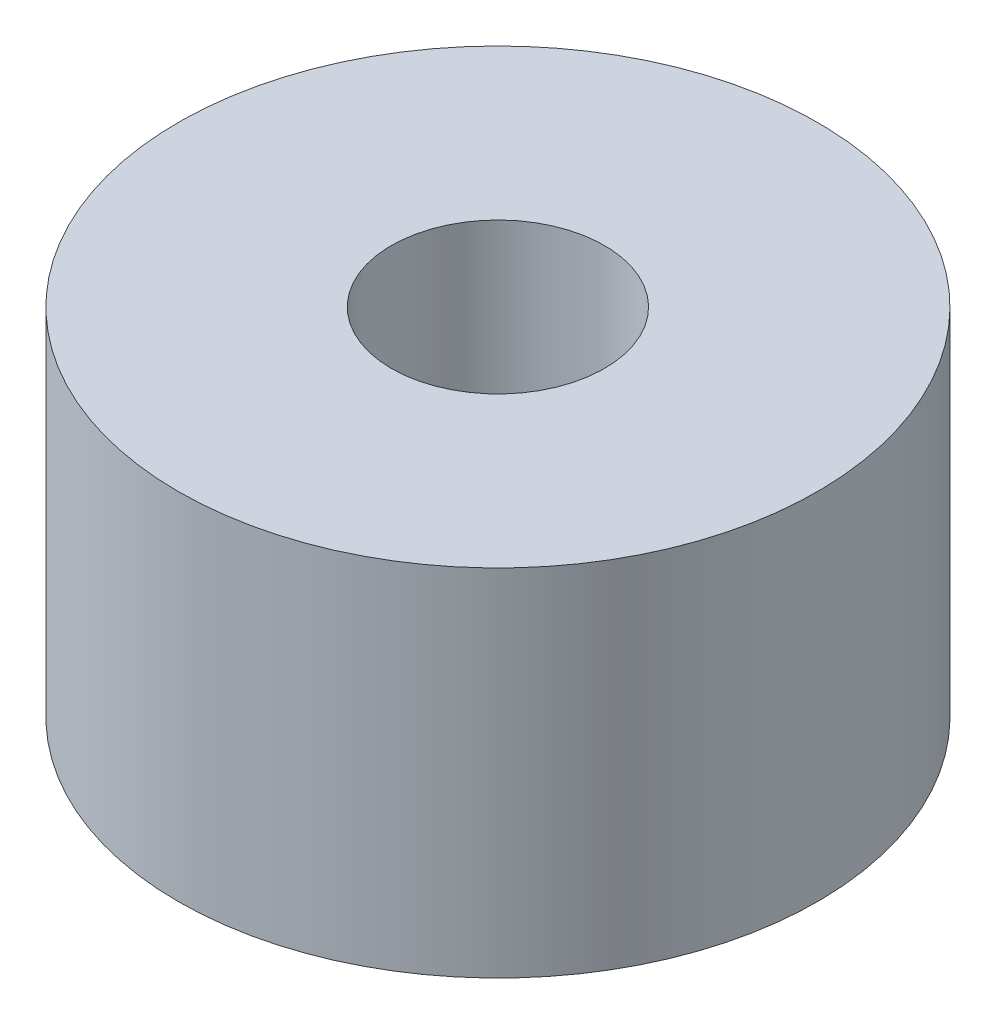
from build123d import *

# Parameters (mm, degrees)
SKETCH1_R           = 4.5
SKETCH1_R_2         = 1.5
BOSS_EXTRUDE1_DEPTH = 5


with BuildPart() as part:
    # Sketch1 → Boss-Extrude1 (new body)
    with BuildSketch(Plane(origin=(0, 0, 0), x_dir=(1, 0, 0), z_dir=(0, 1, 0))):
        with Locations(Location((0, 0, 0), (0, 0, 270))):
            Circle(SKETCH1_R)
        with Locations(Location((0, 0, 0), (0, 0, 270))):
            Circle(SKETCH1_R_2, mode=Mode.SUBTRACT)
    extrude(amount=BOSS_EXTRUDE1_DEPTH)


solid = part.part
